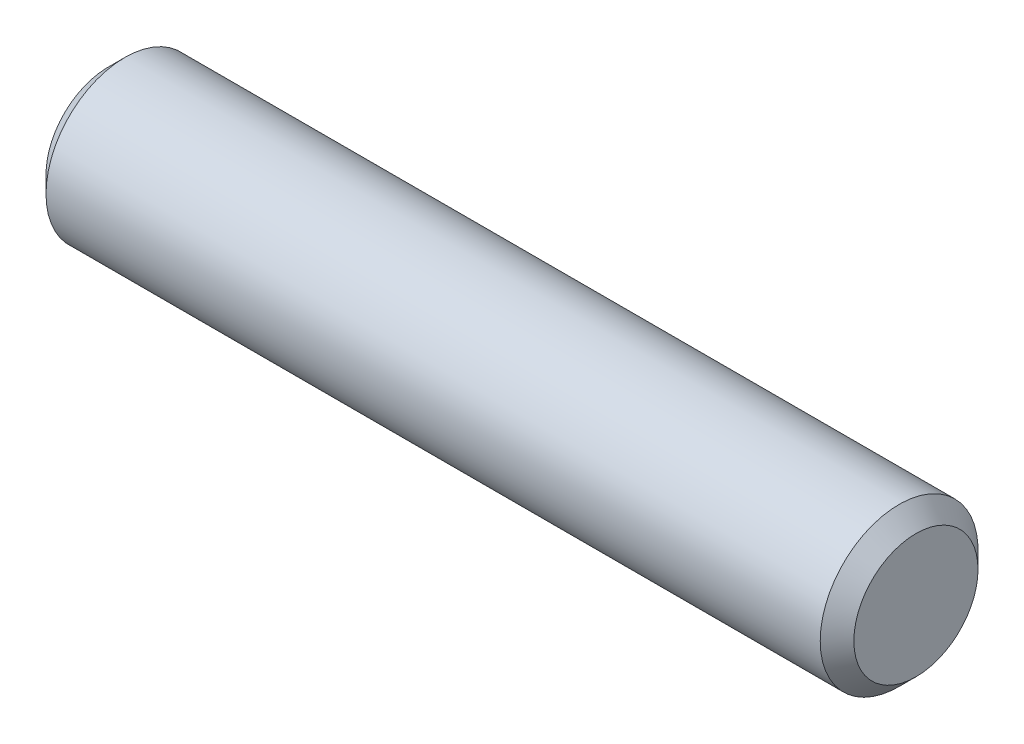
from build123d import *

# Parameters (mm, degrees)
SKETCH1_R      = 1.190625
EXTRUDE1_DEPTH = 6.096
CHAMFER1_SIZE  = 0.254


with BuildPart() as part:
    # Sketch1 → Extrude1 (new, symmetric)
    with BuildSketch(Plane(origin=(0, 0, 0), x_dir=(0, 0, -1), z_dir=(1, 0, 0))):
        with Locations(Location((0, 0, 0), (0, 0, 180))):
            Circle(SKETCH1_R)
    extrude(amount=EXTRUDE1_DEPTH, both=True)

    # Chamfer1
    chamfer1_edges = [part.edges().sort_by_distance(p)[0] for p in [
        (-6.096, 0, -1.190625),
        (6.096, 0, -1.190625),
    ]]
    chamfer(chamfer1_edges, length=CHAMFER1_SIZE)


solid = part.part
